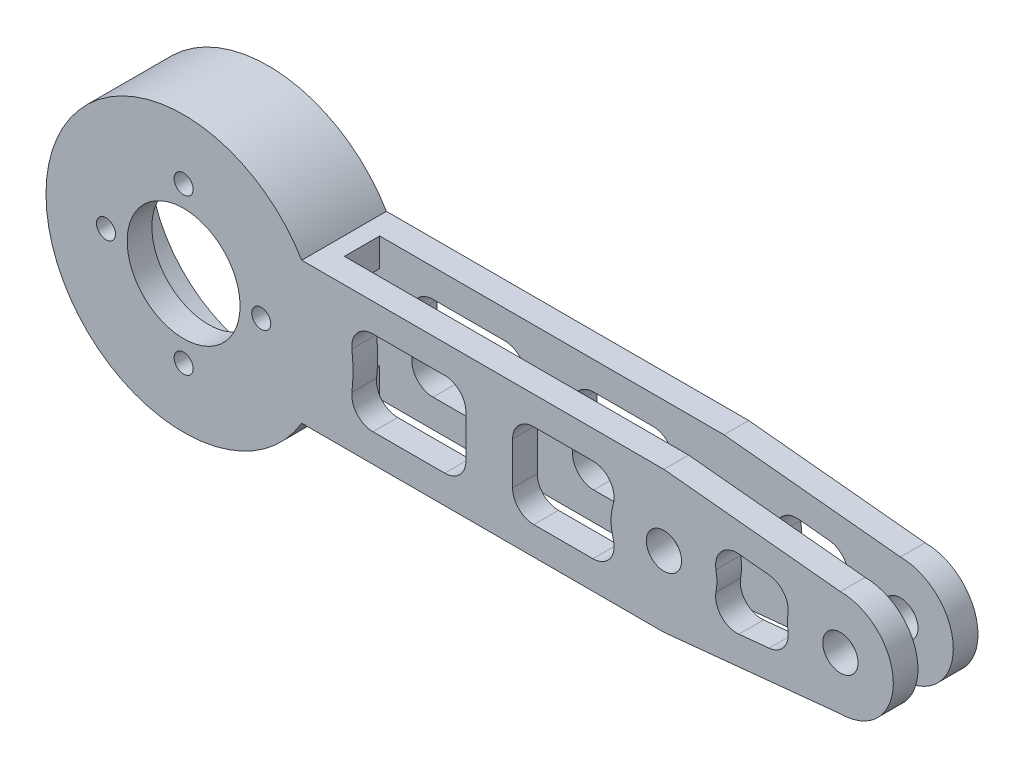
from build123d import *

# Parameters (mm, degrees)
SKETCH_2_R               = 1.35
SKETCH_2_R_2             = 2.5
EXTRUDE_1_DEPTH          = 12
SKETCH_3_W               = 81.279527938
SKETCH_3_H               = 5
CUT_EXTRUDE_1_DEPTH      = 72.933997526
SKETCH_4_R               = 16.9
CUT_EXTRUDE_2_DEPTH      = 8.5
SKETCH_5_R               = 8
CUT_EXTRUDE_3_DEPTH      = 68.917229037
CUT_EXTRUDE_4_REACH      = 86.443
CUT_EXTRUDE_4_END_RADIUS = 16.9
SKETCH_7_W               = 5
SKETCH_7_H               = 12
CUT_EXTRUDE_6_DEPTH      = 69.443407279
SKETCH_9_R               = 16.9
SKETCH_9_R_2             = 1.35
SKETCH_9_R_3             = 8
EXTRUDE_3_DEPTH          = 8.5
SKETCH_10_R              = 16.9
CUT_EXTRUDE_7_DEPTH      = 8.5


with BuildPart() as part:
    # 草图2 → 凸台-拉伸1 (new body)
    with BuildSketch(Plane.XY):
        with BuildLine():
            Line((-28.259330957, 10), (23.06213196, 10))
            Line((23.06213196, 10), (48.06213196, 7.5))
            ThreePointArc((48.06213196, 7.5), (55.56213196, 0), (48.06213196, -7.5))
            Line((48.06213196, -7.5), (23.06213196, -10))
            Line((23.06213196, -10), (-28.259330957, -10))
            ThreePointArc((-28.259330957, -10), (-64.5, 0), (-28.259330957, 10))
        make_face()
        with Locations((-34, 0)):
            Circle(SKETCH_2_R, mode=Mode.SUBTRACT)
        with Locations((-45, -11)):
            Circle(SKETCH_2_R, mode=Mode.SUBTRACT)
        with Locations((-56, 0)):
            Circle(SKETCH_2_R, mode=Mode.SUBTRACT)
        with Locations((-45, 11)):
            Circle(SKETCH_2_R, mode=Mode.SUBTRACT)
        with Locations((48.06213196, 0)):
            Circle(SKETCH_2_R_2, mode=Mode.SUBTRACT)
        with Locations((23.06213196, 0)):
            Circle(SKETCH_2_R_2, mode=Mode.SUBTRACT)
    extrude(amount=EXTRUDE_1_DEPTH)

    # 草图3 → 切除-拉伸1 (cut, through all)
    with BuildSketch(Plane(origin=(0, 10, 0), x_dir=(1, 0, 0), z_dir=(0, 1, 0))):
        with Locations((14.922367991, -6)):
            Rectangle(SKETCH_3_W, SKETCH_3_H)
    extrude(amount=-CUT_EXTRUDE_1_DEPTH, mode=Mode.SUBTRACT)

    # 草图4 → 切除-拉伸2 (cut)
    with BuildSketch(Plane.XY.offset(12)):
        with Locations((-45, 0)):
            Circle(SKETCH_4_R)
    extrude(amount=-CUT_EXTRUDE_2_DEPTH, mode=Mode.SUBTRACT)

    # 草图5 → 切除-拉伸3 (cut, through all)
    with BuildSketch(Plane.XY.offset(3.5)):
        with Locations((-45, 0)):
            Circle(SKETCH_5_R)
    extrude(amount=-CUT_EXTRUDE_3_DEPTH, mode=Mode.SUBTRACT)

    # 切除-拉伸4: up to this cylinder (the profile starts outside it)
    cut_extrude_4_end = Plane(origin=(-45, 0, 6), z_dir=(0, 0, 1)) * Cylinder(CUT_EXTRUDE_4_END_RADIUS, 207.686, mode=Mode.PRIVATE)
    # 草图7 → 切除-拉伸4 (cut, up to the surface)
    with BuildSketch(Plane(origin=(-25.717395978, 0, 0), x_dir=(0, 0, -1), z_dir=(1, 0, 0)), mode=Mode.PRIVATE) as cut_extrude_4_sk1:
        with Locations((-6, 0)):
            Rectangle(SKETCH_7_W, SKETCH_7_H)
    cut_extrude_4_tool1 = extrude(cut_extrude_4_sk1.sketch, amount=-CUT_EXTRUDE_4_REACH, mode=Mode.PRIVATE) - cut_extrude_4_end
    add(cut_extrude_4_tool1.solids().sort_by_distance((-25.717396, 0, 6))[0], mode=Mode.SUBTRACT)

    # 草图8 → 切除-拉伸6 (cut, through all)
    with BuildSketch(Plane.XY.offset(12)):
        with BuildLine():
            Line((-5, 3), (-5, -3))
            ThreePointArc((-5, -3), (-5.878679656, -5.121320344), (-8, -6))
            Line((-8, -6), (-18.16718427, -6))
            ThreePointArc((-18.16718427, -6), (-20.403252248, -5), (-21.14860824, -2.666666667))
            ThreePointArc((-21.14860824, -2.666666667), (-21, 0), (-21.14860824, 2.666666667))
            ThreePointArc((-21.14860824, 2.666666667), (-20.403252248, 5), (-18.16718427, 6))
            Line((-18.16718427, 6), (-8, 6))
            ThreePointArc((-8, 6), (-5.878679656, 5.121320344), (-5, 3))
        make_face()
        with BuildLine():
            Line((1.610541595, 3), (1.610541595, -3))
            ThreePointArc((1.610541595, -3), (2.489221251, -5.121320344), (4.610541595, -6))
            Line((4.610541595, -6), (12.999826061, -6))
            ThreePointArc((12.999826061, -6), (15.405177238, -4.792842914), (15.874770603, -2.142857143))
            ThreePointArc((15.874770603, -2.142857143), (15.56213196, 0), (15.874770603, 2.142857143))
            ThreePointArc((15.874770603, 2.142857143), (15.405177238, 4.792842914), (12.999826061, 6))
            Line((12.999826061, 6), (4.610541595, 6))
            ThreePointArc((4.610541595, 6), (2.489221251, 5.121320344), (1.610541595, 3))
        make_face()
        with BuildLine():
            Line((33.681175083, 4.918145439), (37.968953466, 4.489367601))
            ThreePointArc((37.968953466, 4.489367601), (40.033624407, 3.3523281), (40.639496495, 1.074468593))
            ThreePointArc((40.639496495, 1.074468593), (40.56213196, 0), (40.639496495, -1.074468593))
            ThreePointArc((40.639496495, -1.074468593), (40.033624407, -3.3523281), (37.968953466, -4.489367601))
            Line((37.968953466, -4.489367601), (33.681175083, -4.918145439))
            ThreePointArc((33.681175083, -4.918145439), (31.17263717, -3.961772821), (30.433940507, -1.380738478))
            ThreePointArc((30.433940507, -1.380738478), (30.56213196, 0), (30.433940507, 1.380738478))
            ThreePointArc((30.433940507, 1.380738478), (31.17263717, 3.961772821), (33.681175083, 4.918145439))
        make_face()
    extrude(amount=-CUT_EXTRUDE_6_DEPTH, mode=Mode.SUBTRACT)

    # 草图9 → 凸台-拉伸3 (add)
    with BuildSketch(Plane.XY.offset(3.5)):
        with Locations((-45, 0)):
            Circle(SKETCH_9_R)
        with Locations((-34, 0)):
            Circle(SKETCH_9_R_2, mode=Mode.SUBTRACT)
        with Locations((-45, -11)):
            Circle(SKETCH_9_R_2, mode=Mode.SUBTRACT)
        with Locations((-56, 0)):
            Circle(SKETCH_9_R_2, mode=Mode.SUBTRACT)
        with Locations((-45, 11)):
            Circle(SKETCH_9_R_2, mode=Mode.SUBTRACT)
        with Locations((-45, 0)):
            Circle(SKETCH_9_R_3, mode=Mode.SUBTRACT)
    extrude(amount=EXTRUDE_3_DEPTH)

    # 草图10 → 切除-拉伸7 (cut)
    with BuildSketch(Plane(origin=(0, 0, 0), x_dir=(-1, 0, 0), z_dir=(0, 0, -1))):
        with Locations((45, 0)):
            Circle(SKETCH_10_R)
    extrude(amount=-CUT_EXTRUDE_7_DEPTH, mode=Mode.SUBTRACT)


solid = part.part
